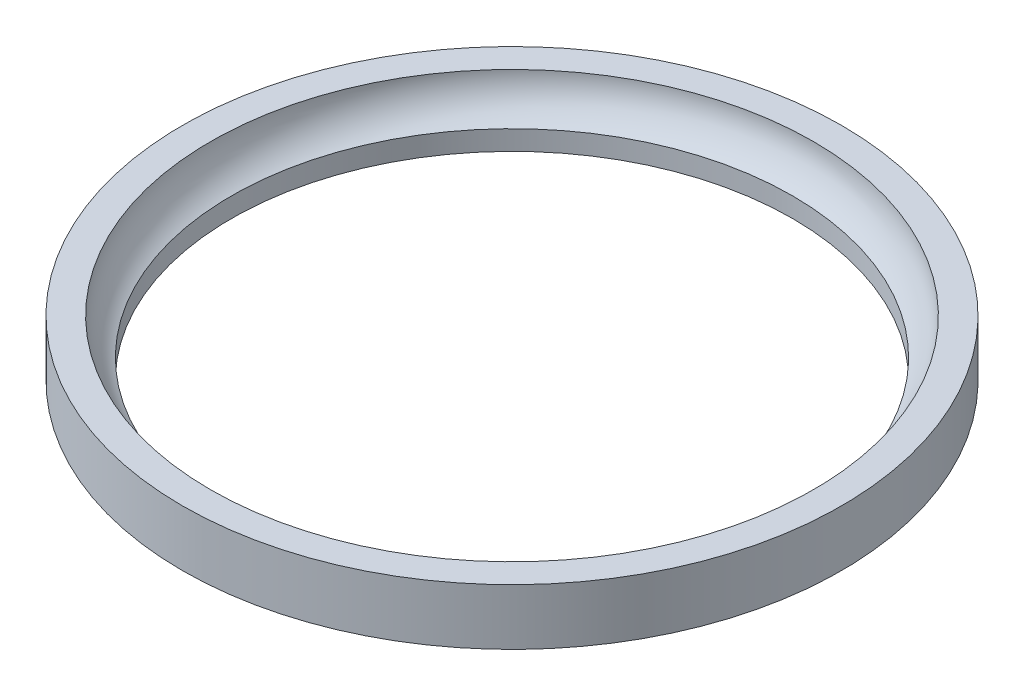
from build123d import *


with BuildPart() as part:
    # Sketch2 → Revolve1 (revolve)
    with BuildSketch(Plane.XY, mode=Mode.PRIVATE) as revolve1_sk:
        with BuildLine():
            Line((10, 0), (10, -0.700961894))
            Line((10, -0.700961894), (11.75, -0.700961894))
            Line((11.75, -0.700961894), (11.75, 1.299038106))
            Line((11.75, 1.299038106), (10.75, 1.299038106))
            ThreePointArc((10.75, 1.299038106), (10.549038106, 0.549038106), (10, 0))
        make_face()
    revolve(revolve1_sk.sketch.rotate(Axis((0, 0, 0), (0, 1, 0)), 90), axis=Axis((0, 0, 0), (0, 1, 0)))


solid = part.part
